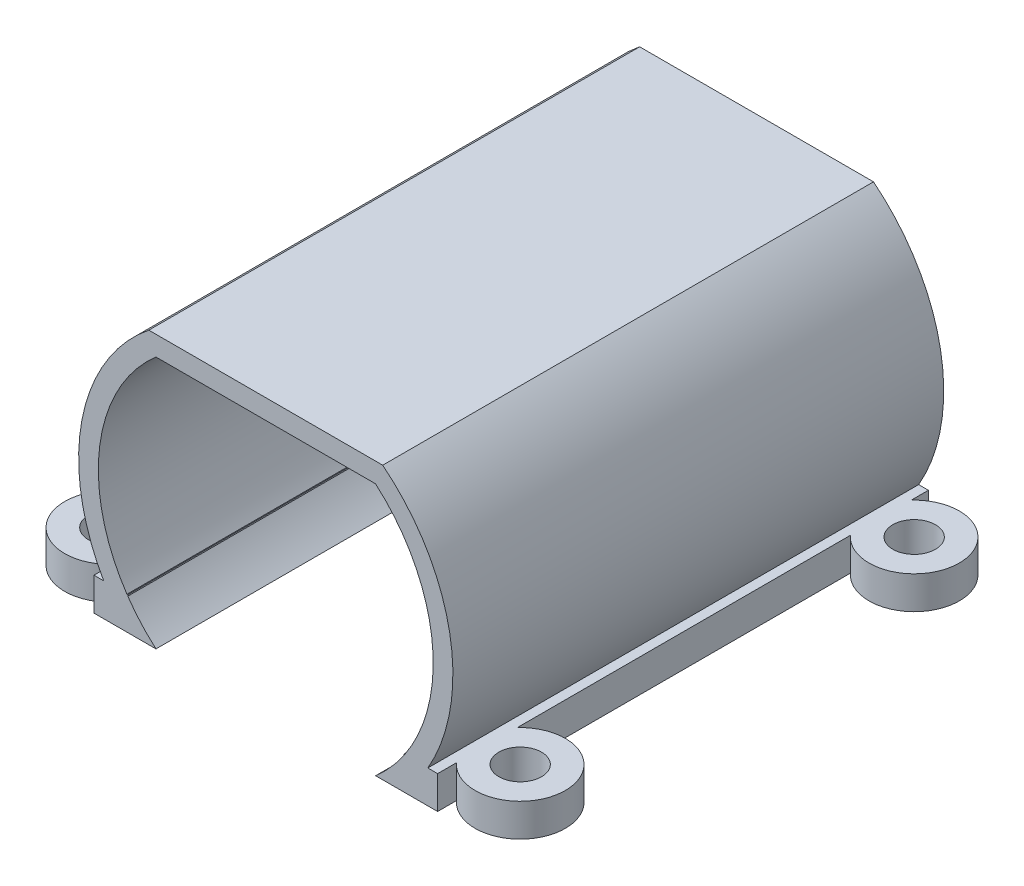
from build123d import *

# Parameters (mm, degrees)
SALIENTE_EXTRUIR1_DEPTH   = 30
VACIADO1_T                = 1.2
CROQUIS2_W                = 41.64599518
CROQUIS2_H                = 31.401201606
CORTAR_EXTRUIR1_DEPTH     = 1.3
CROQUIS3_W                = 19.002401527
CROQUIS3_H                = 2.972205444
CORTAR_EXTRUIR2_DEPTH     = 48.3
CROQUIS4_R                = 2.75
CROQUIS4_R_2              = 1.3
SALIENTE_EXTRUIR2_DEPTH   = 2
SALIENTE_EXTRUIR2_2_DEPTH = 2
SALIENTE_EXTRUIR2_3_DEPTH = 2
SALIENTE_EXTRUIR2_4_DEPTH = 2
CROQUIS5_W                = 2.061100057
CROQUIS5_H                = 29.9
SALIENTE_EXTRUIR3_DEPTH   = 2


with BuildPart() as part:
    # Croquis1 → Saliente-Extruir1 (new body)
    with BuildSketch(Plane.XY):
        with BuildLine():
            Line((-6.68954408, 7.7), (6.68954408, 7.7))
            ThreePointArc((6.68954408, 7.7), (10.2, 0), (6.68954408, -7.7))
            Line((6.68954408, -7.7), (-6.68954408, -7.7))
            ThreePointArc((-6.68954408, -7.7), (-10.2, 0), (-6.68954408, 7.7))
        make_face()
    extrude(amount=SALIENTE_EXTRUIR1_DEPTH)

    # Vaciado1
    vaciado1_openings = [part.faces().sort_by_distance(p)[0] for p in [
        (0, 0, 30),
    ]]
    offset(amount=VACIADO1_T, openings=vaciado1_openings, kind=Kind.INTERSECTION)

    # Croquis2 → Cortar-Extruir1 (cut)
    with BuildSketch(Plane(origin=(0, 0, -1.2), x_dir=(-1, 0, 0), z_dir=(0, 0, -1))):
        Rectangle(CROQUIS2_W, CROQUIS2_H)
    extrude(amount=-CORTAR_EXTRUIR1_DEPTH, mode=Mode.SUBTRACT)

    # Croquis3 → Cortar-Extruir2 (cut)
    with BuildSketch(Plane.XY.offset(30)):
        with Locations((-0.191367802, -9.186102722)):
            Rectangle(CROQUIS3_W, CROQUIS3_H)
    extrude(amount=-CORTAR_EXTRUIR2_DEPTH, mode=Mode.SUBTRACT)



with BuildPart() as body_2:
    # Croquis4 → Saliente-Extruir2 (new body)
    with BuildSketch(Plane.XZ.offset(7.7)):
        with Locations(Location((12.5, 3, 0), (0, 0, 270))):
            Circle(CROQUIS4_R)
        with Locations(Location((12.5, 3, 0), (0, 0, 270))):
            Circle(CROQUIS4_R_2, mode=Mode.SUBTRACT)
    extrude(amount=-SALIENTE_EXTRUIR2_DEPTH)


with BuildPart() as body_3:
    # Croquis4 → Saliente-Extruir2 2 (new body)
    with BuildSketch(Plane.XZ.offset(7.7)):
        with Locations(Location((12.5, 27, 0), (0, 0, 90))):
            Circle(CROQUIS4_R)
        with Locations(Location((12.5, 27, 0), (0, 0, 90))):
            Circle(CROQUIS4_R_2, mode=Mode.SUBTRACT)
    extrude(amount=-SALIENTE_EXTRUIR2_2_DEPTH)


with BuildPart() as body_4:
    # Croquis4 → Saliente-Extruir2 3 (new body)
    with BuildSketch(Plane.XZ.offset(7.7)):
        with Locations(Location((-12.5, 27, 0), (0, 0, 270))):
            Circle(CROQUIS4_R)
        with Locations(Location((-12.5, 27, 0), (0, 0, 270))):
            Circle(CROQUIS4_R_2, mode=Mode.SUBTRACT)
    extrude(amount=-SALIENTE_EXTRUIR2_3_DEPTH)


with BuildPart() as body_5:
    # Croquis4 → Saliente-Extruir2 4 (new body)
    with BuildSketch(Plane.XZ.offset(7.7)):
        with Locations(Location((-12.5, 3, 0), (0, 0, 90))):
            Circle(CROQUIS4_R)
        with Locations(Location((-12.5, 3, 0), (0, 0, 90))):
            Circle(CROQUIS4_R_2, mode=Mode.SUBTRACT)
    extrude(amount=-SALIENTE_EXTRUIR2_4_DEPTH)


with BuildPart() as part_1:
    add(part.part)

    add(body_2.part)  # Saliente-Extruir3 merges body 2

    add(body_3.part)  # Saliente-Extruir3 merges body 3

    add(body_4.part)  # Saliente-Extruir3 merges body 4

    add(body_5.part)  # Saliente-Extruir3 merges body 5
    # Croquis5 → Saliente-Extruir3 (add)
    with BuildSketch(Plane.XZ.offset(7.7)):
        with Locations((-9.437095098, 15.05)):
            Rectangle(CROQUIS5_W, CROQUIS5_H)
        with Locations((9.437095098, 15.05)):
            Rectangle(CROQUIS5_W, CROQUIS5_H)
    extrude(amount=-SALIENTE_EXTRUIR3_DEPTH)


solid = part_1.part
